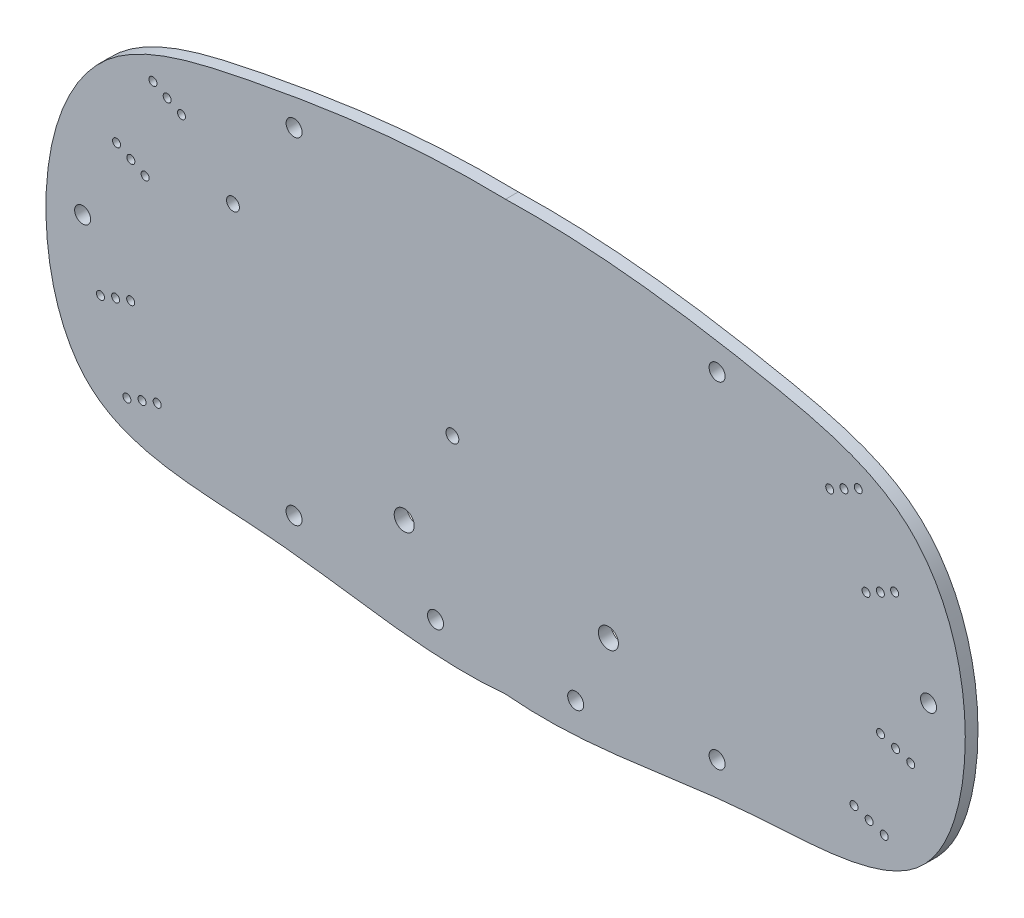
from build123d import *

# Parameters (mm, degrees)
SKETCH2_R           = 2
SKETCH2_R_2         = 1
BOSS_EXTRUDE1_DEPTH = 3.175
SKETCH3_R           = 2.5
CUT_EXTRUDE1_DEPTH  = 158.042768909
SKETCH6_R           = 1.6
CUT_EXTRUDE3_DEPTH  = 158.042768909


with BuildPart() as part:
    # Sketch2 → Boss-Extrude1 (new body)
    with BuildSketch(Plane.XY):
        with BuildLine():
            add(Edge.make_bspline(
                [(0, 0), (-20.953042836, -1.917303519), (-52.065437904, 6.559869489), (-106.076791765, 5.027195947), (-118.905582253, 49.201905636), (-106.996491135, 91.130942668), (-54.792097317, 103.392327906), (-22.685606194, 107.573305963), (0, 107.040782028)],
                knots=[0, 0, 0, 0, 0.212420464, 0.369252369, 0.478798271, 0.640373923, 0.766905531, 1, 1, 1, 1], degree=3))
            add(Edge.make_bspline(
                [(0, 0), (20.953042836, -1.917303519), (52.065437904, 6.559869489), (106.076791765, 5.027195947), (118.905582253, 49.201905636), (106.996491135, 91.130942668), (54.792097317, 103.392327906), (22.685606194, 107.573305963), (0, 107.040782028)],
                knots=[0, 0, 0, 0, 0.212420464, 0.369252369, 0.478798271, 0.640373923, 0.766905531, 1, 1, 1, 1], degree=3))
        make_face()
        with Locations((105.629435859, 50.875493963)):
            Circle(SKETCH2_R, mode=Mode.SUBTRACT)
        with Locations((97.408827326, 36.971043837)):
            Circle(SKETCH2_R_2, mode=Mode.SUBTRACT)
        with Locations((90.790231972, 18.097936103)):
            Circle(SKETCH2_R_2, mode=Mode.SUBTRACT)
        with Locations((90.025202431, 67.044063381)):
            Circle(SKETCH2_R_2, mode=Mode.SUBTRACT)
        with Locations((80.946686803, 84.864853319)):
            Circle(SKETCH2_R_2, mode=Mode.SUBTRACT)
        with Locations((52.824538288, 12.232829458)):
            Circle(SKETCH2_R, mode=Mode.SUBTRACT)
        with Locations((17.5, 7.377206693)):
            Circle(SKETCH2_R, mode=Mode.SUBTRACT)
        with Locations(Location((-17.5, 7.377206693, 0), (0, 0, 180))):
            Circle(SKETCH2_R, mode=Mode.SUBTRACT)
        with Locations(Location((-52.824538288, 12.232829458, 0), (0, 0, 180))):
            Circle(SKETCH2_R, mode=Mode.SUBTRACT)
        with Locations(Location((-105.629435859, 50.875493963, 0), (0, 0, 180))):
            Circle(SKETCH2_R, mode=Mode.SUBTRACT)
        with Locations((93.634205779, 38.294762908)):
            Circle(SKETCH2_R_2, mode=Mode.SUBTRACT)
        with Locations((87.015610425, 19.421655174)):
            Circle(SKETCH2_R_2, mode=Mode.SUBTRACT)
        with Locations(Location((84.51084479, 86.680556444, 0), (0, 0, 180))):
            Circle(SKETCH2_R_2, mode=Mode.SUBTRACT)
        with Locations(Location((93.589360419, 68.859766507, 0), (0, 0, 180))):
            Circle(SKETCH2_R_2, mode=Mode.SUBTRACT)
        with Locations(Location((88.075002778, 88.49625957, 0), (0, 0, 180))):
            Circle(SKETCH2_R_2, mode=Mode.SUBTRACT)
        with Locations(Location((97.153518406, 70.675469633, 0), (0, 0, 180))):
            Circle(SKETCH2_R_2, mode=Mode.SUBTRACT)
        with Locations(Location((101.183448873, 35.647324767, 0), (0, 0, 180))):
            Circle(SKETCH2_R_2, mode=Mode.SUBTRACT)
        with Locations(Location((94.564853519, 16.774217033, 0), (0, 0, 180))):
            Circle(SKETCH2_R_2, mode=Mode.SUBTRACT)
        with Locations((52.824538288, 96.099280066)):
            Circle(SKETCH2_R, mode=Mode.SUBTRACT)
        with Locations(Location((-52.824538288, 96.099280066, 0), (0, 0, 180))):
            Circle(SKETCH2_R, mode=Mode.SUBTRACT)
        with Locations(Location((-90.025202431, 67.044063381, 0), (0, 0, 180))):
            Circle(SKETCH2_R_2, mode=Mode.SUBTRACT)
        with Locations((-93.589360419, 68.859766507)):
            Circle(SKETCH2_R_2, mode=Mode.SUBTRACT)
        with Locations((-97.153518406, 70.675469633)):
            Circle(SKETCH2_R_2, mode=Mode.SUBTRACT)
        with Locations((-88.075002778, 88.49625957)):
            Circle(SKETCH2_R_2, mode=Mode.SUBTRACT)
        with Locations((-84.51084479, 86.680556444)):
            Circle(SKETCH2_R_2, mode=Mode.SUBTRACT)
        with Locations(Location((-80.946686803, 84.864853319, 0), (0, 0, 180))):
            Circle(SKETCH2_R_2, mode=Mode.SUBTRACT)
        with Locations((-101.183448873, 35.647324767)):
            Circle(SKETCH2_R_2, mode=Mode.SUBTRACT)
        with Locations(Location((-97.408827326, 36.971043837, 0), (0, 0, 180))):
            Circle(SKETCH2_R_2, mode=Mode.SUBTRACT)
        with Locations(Location((-93.634205779, 38.294762908, 0), (0, 0, 180))):
            Circle(SKETCH2_R_2, mode=Mode.SUBTRACT)
        with Locations((-94.564853519, 16.774217033)):
            Circle(SKETCH2_R_2, mode=Mode.SUBTRACT)
        with Locations(Location((-90.790231972, 18.097936103, 0), (0, 0, 180))):
            Circle(SKETCH2_R_2, mode=Mode.SUBTRACT)
        with Locations(Location((-87.015610425, 19.421655174, 0), (0, 0, 180))):
            Circle(SKETCH2_R_2, mode=Mode.SUBTRACT)
    extrude(amount=BOSS_EXTRUDE1_DEPTH)

    # Sketch3 → Cut-Extrude1 (cut, through all)
    with BuildSketch(Plane.XY.offset(3.175)):
        with Locations((25.67875751, 24.983800797)):
            Circle(SKETCH3_R)
        with Locations(Location((-25.32124249, 24.983800797, 0), (0, 0, 180))):
            Circle(SKETCH3_R)
    extrude(amount=-CUT_EXTRUDE1_DEPTH, mode=Mode.SUBTRACT)

    # Sketch6 → Cut-Extrude3 (cut, through all)
    with BuildSketch(Plane.XY.offset(3.175)):
        with Locations((-13.286825274, 49.207700743)):
            Circle(SKETCH6_R)
        with Locations((-68.086825274, 72.007700743)):
            Circle(SKETCH6_R)
    extrude(amount=-CUT_EXTRUDE3_DEPTH, mode=Mode.SUBTRACT)


solid = part.part
